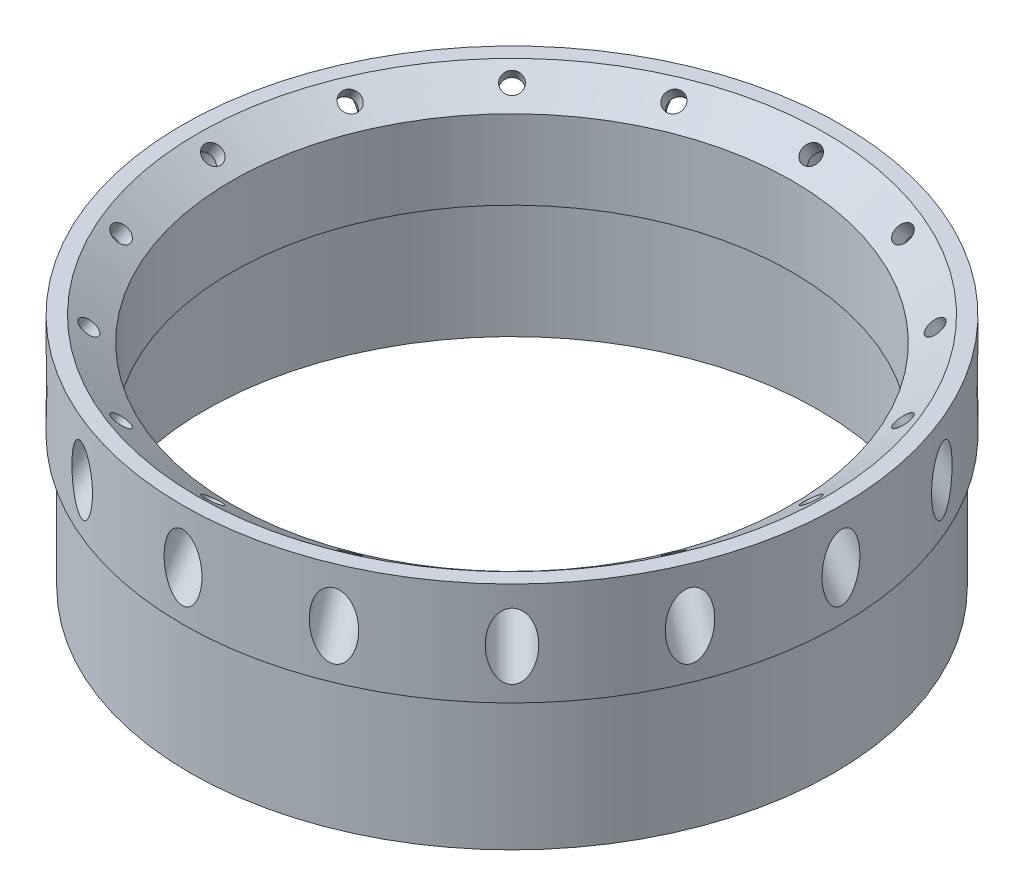
from build123d import *

# Parameters (mm, degrees)
HOLE_START                = -3
SKETCH14_R                = 5
HOLE_EXTRUDE_1_DEPTH      = 150.91522103
SCREW_EXTRUDE_D           = 5
SCREW_HOLES_PATTERN_COUNT = 16


with BuildPart() as part:
    # Main sketch → Main revolve (revolve)
    with BuildSketch(Plane.XY, mode=Mode.PRIVATE) as main_revolve_sk:
        Polygon((-85, -35), (-81, -35), (-81, 0), (-74, 0), (-74, 20.897302003), (-83, 27.199169847), (-87, 27.199169847), (-87, 0), (-85, 0), align=None)
    revolve(main_revolve_sk.sketch.rotate(Axis((0, 0, 0), (0, -1, 0)), 270), axis=Axis((0, 0, 0), (0, -1, 0)))

    # Sketch14 → Hole extrude 1 (cut)
    with BuildSketch(Plane(origin=(-18.526734454, -26.458918881, 0), x_dir=(0.8191520442889891, -0.5735764363510499, 0), z_dir=(-0.5735764363510499, -0.8191520442889891, 0)).offset(HOLE_START)):
        with Locations(Location((-78.707324234, 0, 0), (0, 0, 180))):
            Circle(SKETCH14_R)
    hole_extrude_1 = extrude(amount=HOLE_EXTRUDE_1_DEPTH, mode=Mode.SUBTRACT)

    # screw extrude (through all)
    with Locations(Plane(origin=(-81.279270691, 21.1432038, 0), x_dir=(-0.819152044289, 0.573576436351, 0), z_dir=(-0.573576436351, -0.819152044289, 0))):
        with Locations((0, 0)):
            screw_extrude = Hole(SCREW_EXTRUDE_D / 2)

    # Screw holes pattern: Hole extrude 1, screw extrude ×16 about axis
    screw_holes_pattern_axis = Axis((0, 0, 0), (0, 1, 0))
    add([hole_extrude_1.rotate(screw_holes_pattern_axis, i * 360 / SCREW_HOLES_PATTERN_COUNT) for i in range(1, SCREW_HOLES_PATTERN_COUNT)], mode=Mode.SUBTRACT)
    add([screw_extrude.rotate(screw_holes_pattern_axis, i * 360 / SCREW_HOLES_PATTERN_COUNT) for i in range(1, SCREW_HOLES_PATTERN_COUNT)], mode=Mode.SUBTRACT)


solid = part.part
